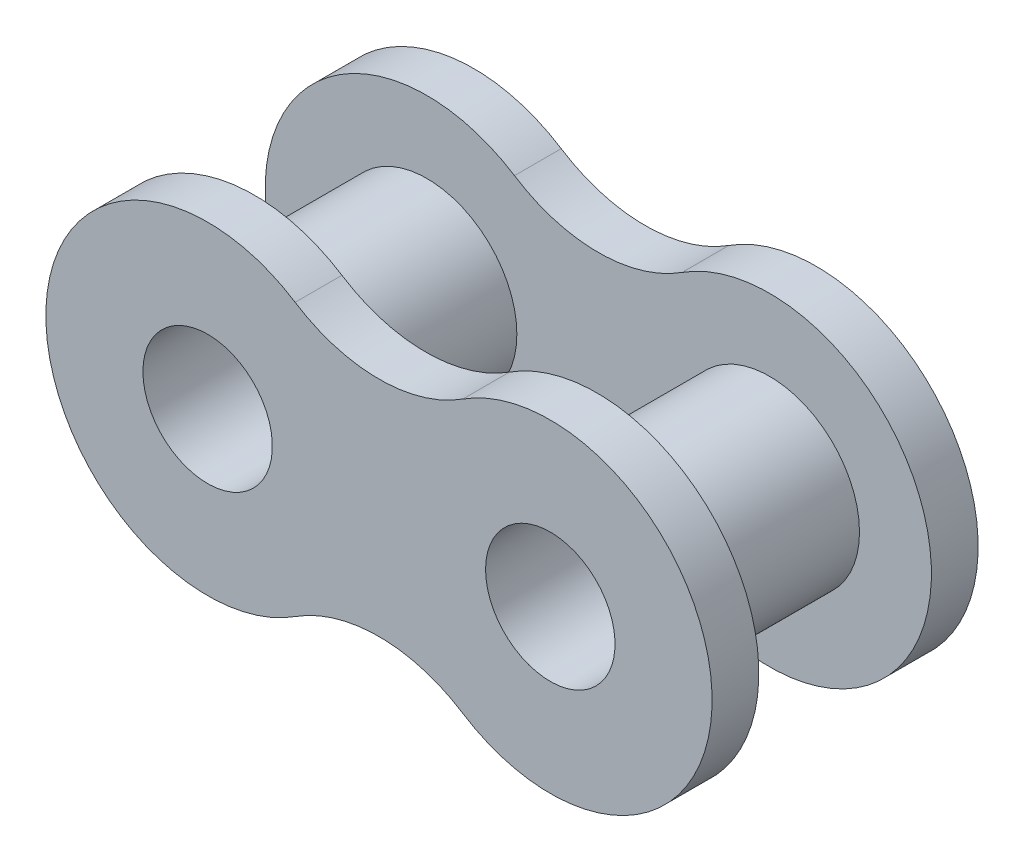
from build123d import *

# Parameters (mm, degrees)
BOSS_EXTRUDE1_DEPTH     = 1.3
SKETCH2_R               = 2.5
SKETCH2_R_2             = 1.8
BOSS_EXTRUDE2_DEPTH     = 5
CUT_EXTRUDE1_DEPTH      = 11.944415242
CUT_EXTRUDE1_DEPTH_BACK = 11.944415242
SKETCH4_R               = 1.8


with BuildPart() as part:
    # Sketch1 → Boss-Extrude1 (new body)
    with BuildSketch(Plane.XY):
        with BuildLine():
            ThreePointArc((-2.33084422, 3.784823066), (-9.265, 0), (-2.33084422, -3.784823066))
            ThreePointArc((-2.33084422, -3.784823066), (0, -3.1), (2.33084422, -3.784823066))
            ThreePointArc((2.33084422, -3.784823066), (9.265, 0), (2.33084422, 3.784823066))
            ThreePointArc((2.33084422, 3.784823066), (0, 3.1), (-2.33084422, 3.784823066))
        make_face()
    boss_extrude1 = extrude(amount=BOSS_EXTRUDE1_DEPTH)

    # Sketch2 → Boss-Extrude2 (add)
    # profile 1 of 2: a face of its own
    with BuildSketch(Plane.XY.offset(1.3)):
        with Locations(Location((-4.765, 0, 0), (0, 0, 180))):
            Circle(SKETCH2_R)
        with Locations((-4.765, 0)):
            Circle(SKETCH2_R_2, mode=Mode.SUBTRACT)
    # profile 2 of 2: a face of its own
    with BuildSketch(Plane.XY.offset(1.3)):
        with Locations(Location((4.765, 0, 0), (0, 0, 180))):
            Circle(SKETCH2_R)
        with Locations((4.765, 0)):
            Circle(SKETCH2_R_2, mode=Mode.SUBTRACT)
    extrude(amount=BOSS_EXTRUDE2_DEPTH)

    # Mirror5: Boss-Extrude1 across plane
    add(boss_extrude1.mirror(Plane(origin=(0, 0, 3.7), x_dir=(1, 0, 0), z_dir=(0, 0, -1))))

    # Sketch4 → Cut-Extrude1 (cut, two sides: drawn at the far end of the back side and taken through both)
    with BuildSketch(Plane(origin=(0, 0, 3.7), x_dir=(-1, 0, 0), z_dir=(0, 0, -1)).offset(-CUT_EXTRUDE1_DEPTH_BACK)):
        with Locations((-4.765, 0)):
            Circle(SKETCH4_R)
        with Locations((4.765, 0)):
            Circle(SKETCH4_R)
    extrude(amount=CUT_EXTRUDE1_DEPTH + CUT_EXTRUDE1_DEPTH_BACK, mode=Mode.SUBTRACT)


solid = part.part
